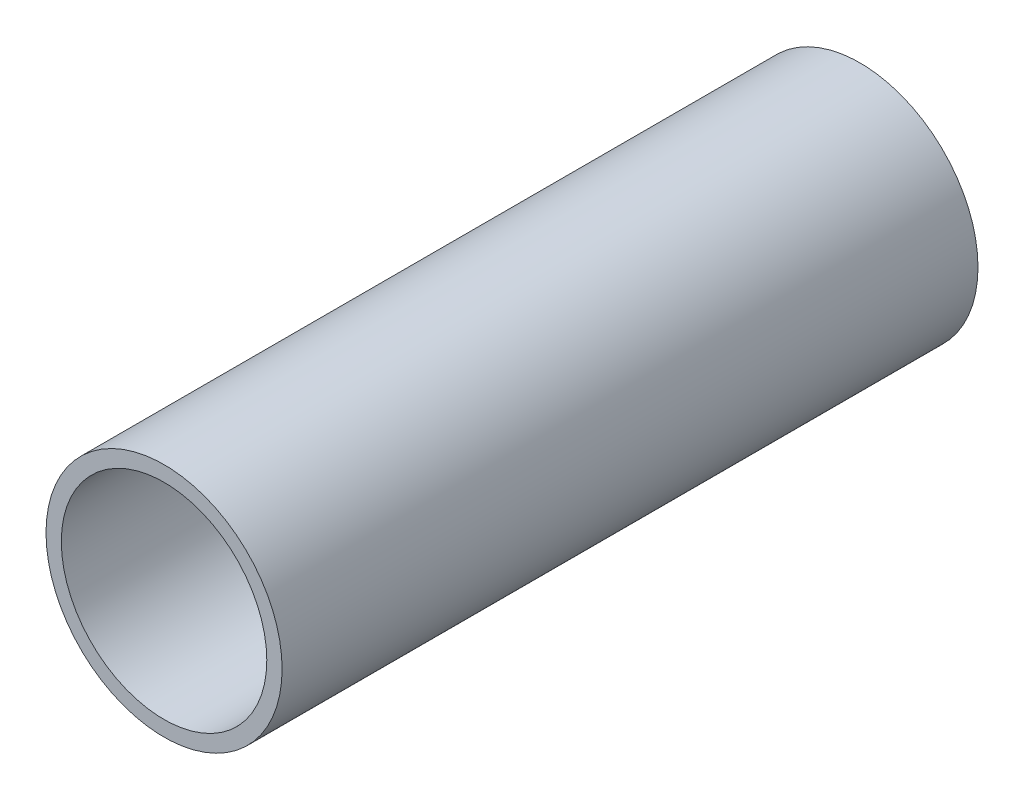
from build123d import *

# Parameters (mm, degrees)
SKETCH1_R           = 30.1625
SKETCH1_R_2         = 26.2509
BOSS_EXTRUDE1_DEPTH = 177.8


with BuildPart() as part:
    # Sketch1 → Boss-Extrude1 (new body)
    with BuildSketch(Plane.XY):
        Circle(SKETCH1_R)
        Circle(SKETCH1_R_2, mode=Mode.SUBTRACT)
    extrude(amount=BOSS_EXTRUDE1_DEPTH)


solid = part.part
